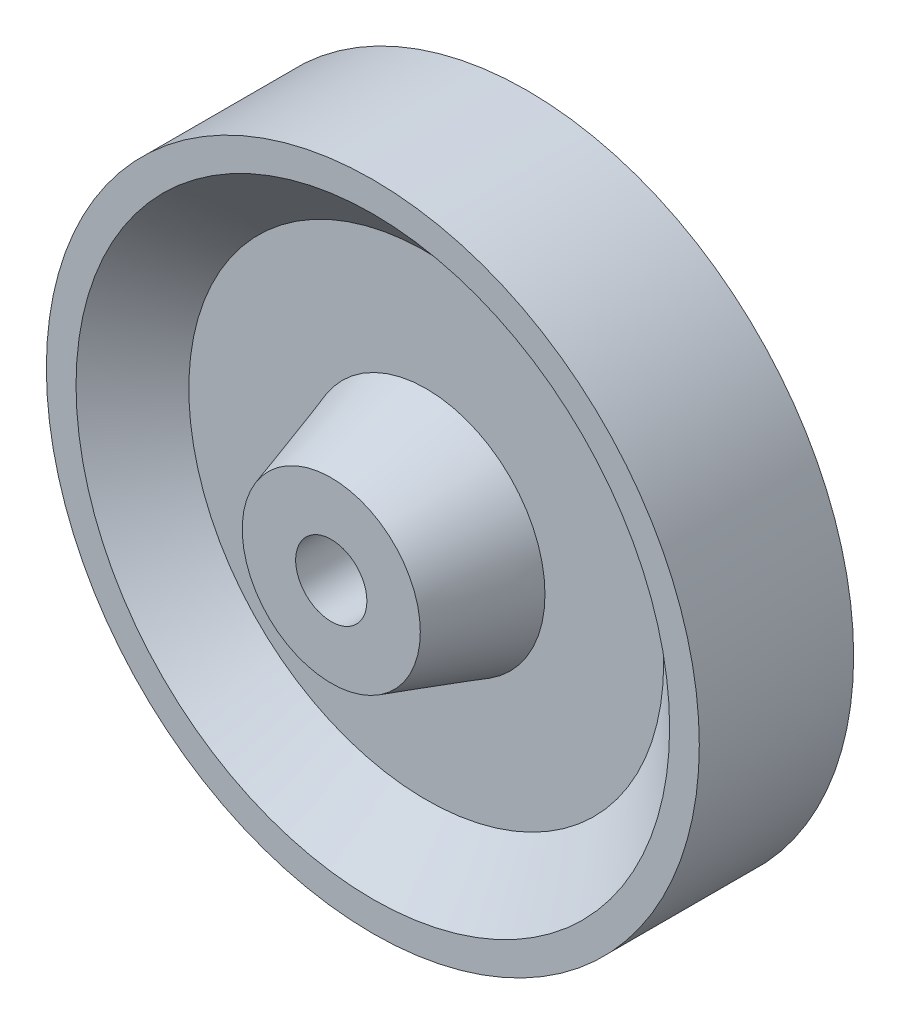
from build123d import *


with BuildPart() as part:
    # Sketch1 → Revolve1 (revolve)
    with BuildSketch(Plane(origin=(0, 0, 0), x_dir=(0, 0, -1), z_dir=(1, 0, 0)), mode=Mode.PRIVATE) as revolve1_sk:
        Polygon((13, 55), (13, 50), (4, 40), (4, 20), (20, 15), (20, 6), (-20, 6), (-20, 15), (-4, 20), (-4, 40), (-13, 50), (-13, 55), align=None)
    revolve(revolve1_sk.sketch.rotate(Axis((0, 0, 0), (0, 0, -1)), 90), axis=Axis((0, 0, 0), (0, 0, -1)))


solid = part.part
